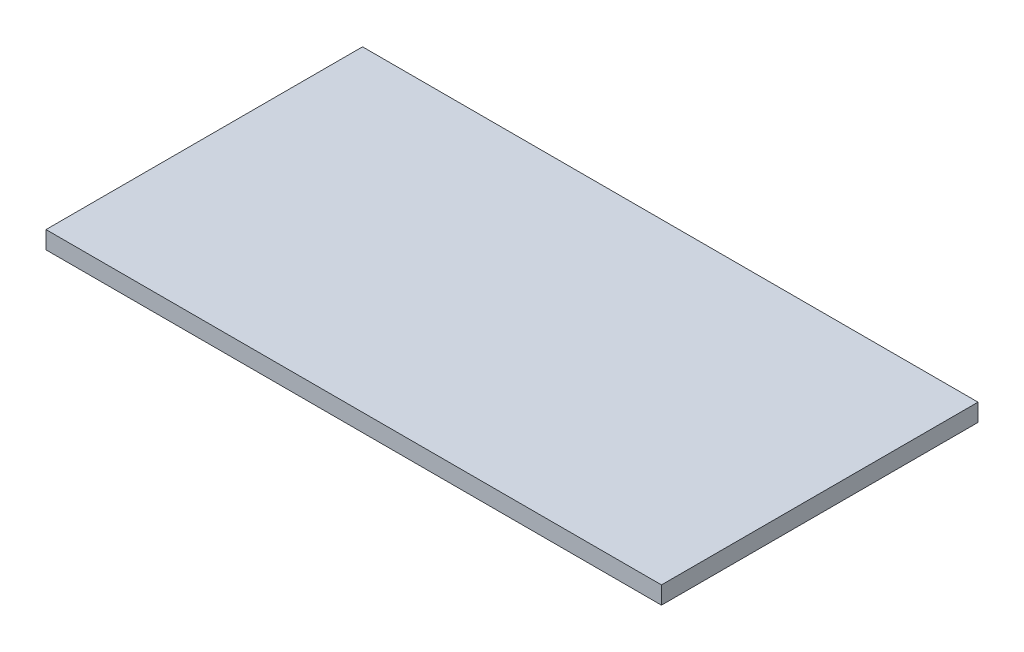
from build123d import *

# Parameters (mm, degrees)
SKETCH1_W           = 175
SKETCH1_H           = 90
BOSS_EXTRUDE1_DEPTH = 5


with BuildPart() as part:
    # Sketch1 → Boss-Extrude1 (new body)
    with BuildSketch(Plane(origin=(0, 0, 0), x_dir=(1, 0, 0), z_dir=(0, 1, 0))):
        with Locations((87.5, -45)):
            Rectangle(SKETCH1_W, SKETCH1_H)
    extrude(amount=BOSS_EXTRUDE1_DEPTH)


solid = part.part
